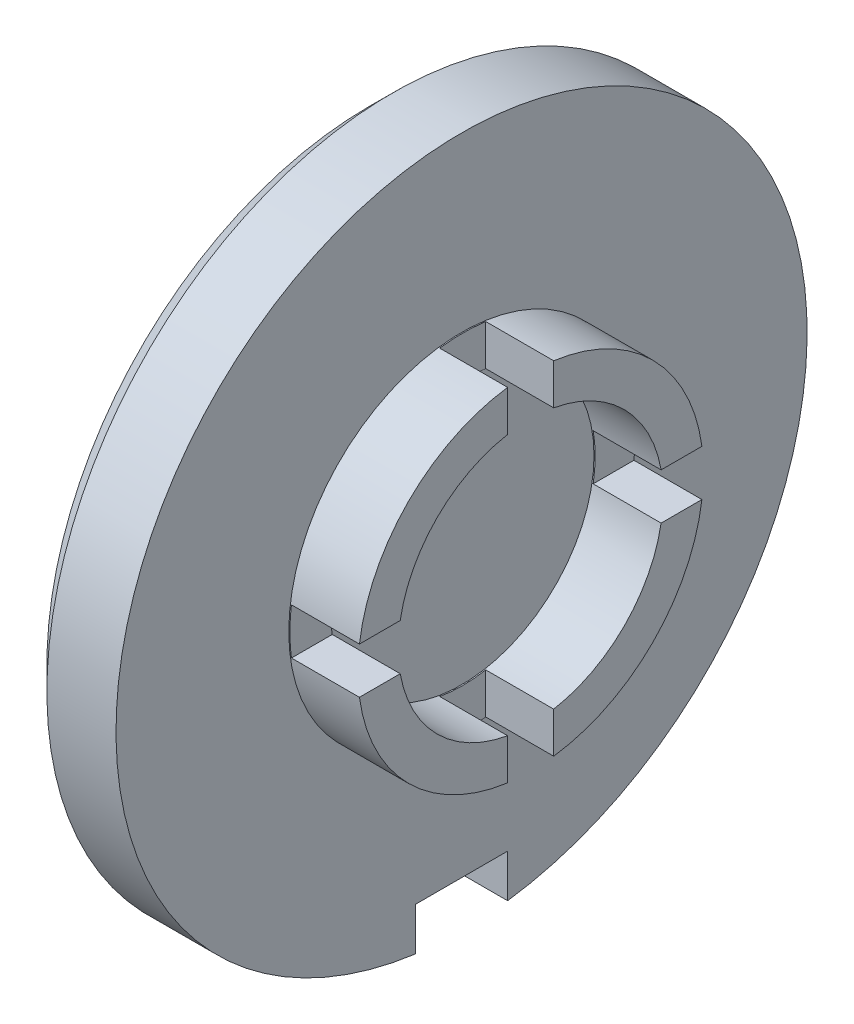
from build123d import *

# Parameters (mm, degrees)
BOSS_EXTRUDE1_START = -55.2
SKETCH2_W           = 1.28
SKETCH2_H           = 0.8
BOSS_EXTRUDE1_DEPTH = 6.4
BOSS_EXTRUDE2_START = -52.4
SKETCH3_W           = 1.28
SKETCH3_H           = 6.4
BOSS_EXTRUDE2_DEPTH = 0.8
BOSS_EXTRUDE3_START = -52.8
SKETCH4_W           = 1.8
SKETCH4_H           = 0.9
BOSS_EXTRUDE3_DEPTH = 1.6


with BuildPart() as part:
    # Sketch1 → Revolve1 (revolve)
    with BuildSketch(Plane.XY.offset(-52), mode=Mode.PRIVATE) as revolve1_sk:
        Polygon((-74, -17.7), (-75.2, -17.7), (-75.2, -20), (-76.8, -20), (-76.8, -14.4), (-76.4, -14), (-75.2, -14), (-75.2, -17), (-74, -17), align=None)
    revolve(revolve1_sk.sketch.rotate(Axis((-81.8, -20, -52), (1, 0, 0)), 90), axis=Axis((-81.8, -20, -52), (1, 0, 0)))


with BuildPart() as body_2:
    # Sketch2 → Boss-Extrude1 (new body)
    with BuildSketch(Plane.XY.offset(BOSS_EXTRUDE1_START)):
        with Locations((-74.54, -20)):
            Rectangle(SKETCH2_W, SKETCH2_H)
    extrude(amount=BOSS_EXTRUDE1_DEPTH)


with BuildPart() as part_1:
    add(part.part)

    # Combine1: cut body 2
    add(body_2.part, mode=Mode.SUBTRACT)


with BuildPart() as body_2_2:
    # Sketch3 → Boss-Extrude2 (new body)
    with BuildSketch(Plane.XY.offset(BOSS_EXTRUDE2_START)):
        with Locations((-74.54, -20)):
            Rectangle(SKETCH3_W, SKETCH3_H)
    extrude(amount=BOSS_EXTRUDE2_DEPTH)


with BuildPart() as part_2:
    add(part_1.part)

    # Combine2: cut body 2 2
    add(body_2_2.part, mode=Mode.SUBTRACT)


with BuildPart() as body_2_3:
    # Sketch4 → Boss-Extrude3 (new body)
    with BuildSketch(Plane.XY.offset(BOSS_EXTRUDE3_START)):
        with Locations((-76, -25.65)):
            Rectangle(SKETCH4_W, SKETCH4_H)
    extrude(amount=BOSS_EXTRUDE3_DEPTH)


with BuildPart() as part_3:
    add(part_2.part)

    # Combine3: cut body 2 3
    add(body_2_3.part, mode=Mode.SUBTRACT)


solid = part_3.part
